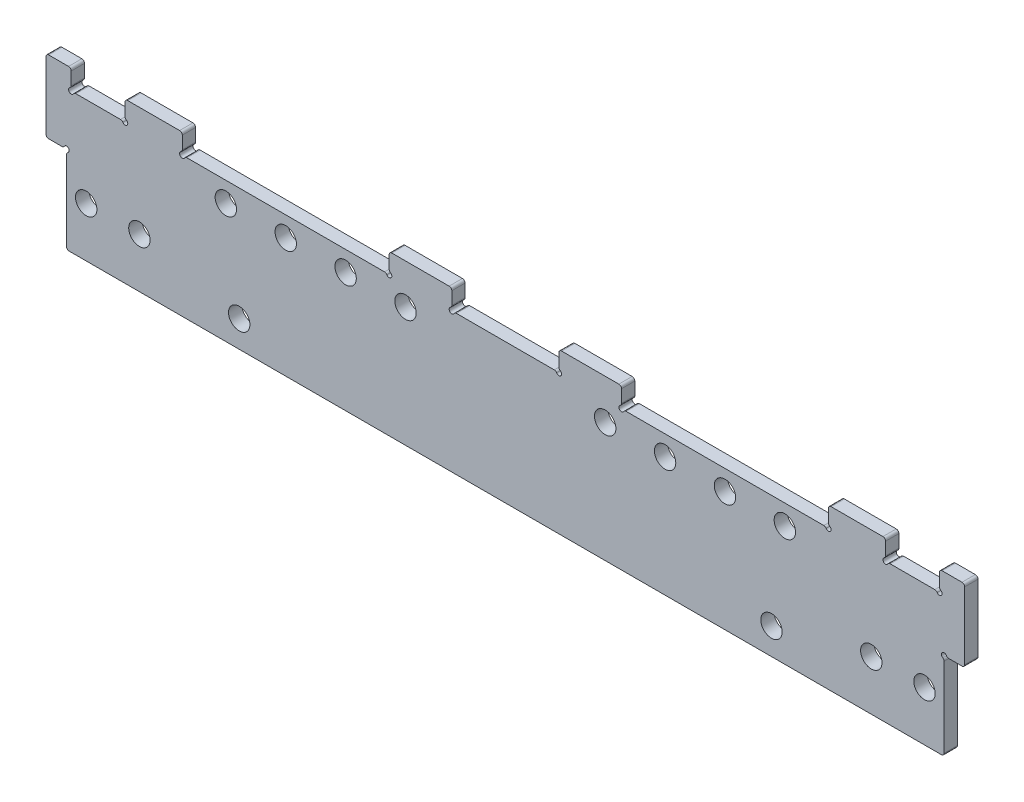
from build123d import *

# Parameters (mm, degrees)
SKETCH41_R                  = 2.5527
BACK_PLATE_EXTRUDE_DEPTH    = 3.175
SKETCH71_W                  = 8.89
SKETCH71_H                  = 4.7625
SKETCH71_W_2                = 13.79855
SKETCH71_W_3                = 15.09395
BOSS_EXTRUDE26_DEPTH        = 3.175
SKETCH91_W                  = 4.9022
SKETCH91_H                  = 20.7645
SKETCH91_W_2                = 12.8524
SKETCH91_H_2                = 4.7625
SKETCH91_W_3                = 49.3649
SKETCH91_W_4                = 12.7762
BACK_PLATE_TOLERENCES_DEPTH = 117.415175369
SKETCH92_W                  = 2.794
SKETCH92_H                  = 26.9875
CUT_EXTRUDE1_DEPTH          = 117.415175369
FILLET27_R                  = 0.635
FILLET28_R                  = 0.635
SKETCH93_R                  = 0.635
CUT_EXTRUDE2_DEPTH          = 114.719990469
FILLET29_R                  = 0.635
FILLET29_OF_MIRROR26_R      = 0.635


with BuildPart() as part:
    # Sketch41 → Back Plate Extrude------------ (new body)
    with BuildSketch(Plane.XY.offset(152.527)):
        Polygon((-104.775, -7.9375), (-104.775, 12.7), (-109.5248, 12.7), (-109.5248, 3.175), (-112.395, 3.175), (-112.395, 25.4), (-104.775, 25.4), (104.775, 25.4), (112.395, 25.4), (112.395, 3.175), (109.5248, 3.175), (109.5248, 12.7), (104.775, 12.7), (104.775, -7.9375), align=None)
        with Locations((-100.0125, 3.9624)):
            Circle(SKETCH41_R, mode=Mode.SUBTRACT)
        with Locations((100.0125, 3.9624)):
            Circle(SKETCH41_R, mode=Mode.SUBTRACT)
        with Locations((23.8252, 20.6375)):
            Circle(SKETCH41_R, mode=Mode.SUBTRACT)
        with Locations((38.1127, 20.6375)):
            Circle(SKETCH41_R, mode=Mode.SUBTRACT)
        with Locations((52.4002, 20.6375)):
            Circle(SKETCH41_R, mode=Mode.SUBTRACT)
        with Locations((66.6877, 20.6375)):
            Circle(SKETCH41_R, mode=Mode.SUBTRACT)
        with Locations(Location((-66.6877, 20.6375, 0), (0, 0, 180))):
            Circle(SKETCH41_R, mode=Mode.SUBTRACT)
        with Locations(Location((-52.4002, 20.6375, 0), (0, 0, 180))):
            Circle(SKETCH41_R, mode=Mode.SUBTRACT)
        with Locations(Location((-38.1127, 20.6375, 0), (0, 0, 180))):
            Circle(SKETCH41_R, mode=Mode.SUBTRACT)
        with Locations(Location((-23.8252, 20.6375, 0), (0, 0, 180))):
            Circle(SKETCH41_R, mode=Mode.SUBTRACT)
        with Locations((-87.3125, 3.9624)):
            Circle(SKETCH41_R, mode=Mode.SUBTRACT)
        with Locations(Location((87.3125, 3.9624, 0), (0, 0, 180))):
            Circle(SKETCH41_R, mode=Mode.SUBTRACT)
        with Locations((-63.5, -1.5875)):
            Circle(SKETCH41_R, mode=Mode.SUBTRACT)
        with Locations((63.5, -1.5875)):
            Circle(SKETCH41_R, mode=Mode.SUBTRACT)
    extrude(amount=BACK_PLATE_EXTRUDE_DEPTH)

    # Sketch71 → Boss-Extrude26 (add, through all)
    with BuildSketch(Plane.XY.offset(155.702)):
        with Locations((-107.95, 27.78125)):
            Rectangle(SKETCH71_W, SKETCH71_H)
        with Locations((-83.905725, 27.78125)):
            Rectangle(SKETCH71_W_2, SKETCH71_H)
        with Locations((-20.246975, 27.78125)):
            Rectangle(SKETCH71_W_3, SKETCH71_H)
    boss_extrude26 = extrude(amount=-BOSS_EXTRUDE26_DEPTH)

    # Mirror23: Boss-Extrude26 across plane
    add(boss_extrude26.mirror(Plane(origin=(0, 0, 0), x_dir=(0, 0, 1), z_dir=(1, 0, 0))))

    # Sketch91 → Back Plate Tolerences (cut, through all)
    with BuildSketch(Plane(origin=(0, 0, 152.527), x_dir=(-1, 0, 0), z_dir=(0, 0, -1))):
        with Locations((-107.1499, 2.44475)):
            Rectangle(SKETCH91_W, SKETCH91_H)
        with Locations((-97.155, 27.78125)):
            Rectangle(SKETCH91_W_2, SKETCH91_H_2)
        with Locations((-52.4002, 27.78125)):
            Rectangle(SKETCH91_W_3, SKETCH91_H_2)
        with Locations((-6.3881, 27.78125)):
            Rectangle(SKETCH91_W_4, SKETCH91_H_2)
    back_plate_tolerences = extrude(amount=-BACK_PLATE_TOLERENCES_DEPTH, mode=Mode.SUBTRACT)

    # Mirror25: Back Plate Tolerences across plane
    add(back_plate_tolerences.mirror(Plane(origin=(0, 0, 0), x_dir=(0, 0, 1), z_dir=(1, 0, 0))), mode=Mode.SUBTRACT)

    # Sketch92 → Cut-Extrude1 (cut, through all)
    with BuildSketch(Plane.XY.offset(155.702)):
        with Locations((-110.998, 16.66875)):
            Rectangle(SKETCH92_W, SKETCH92_H)
        with Locations((110.998, 16.66875)):
            Rectangle(SKETCH92_W, SKETCH92_H)
    extrude(amount=-CUT_EXTRUDE1_DEPTH, mode=Mode.SUBTRACT)

    # Fillet27
    fillet27_edges = [part.edges().sort_by_distance(p)[0] for p in [
        (104.6988, -7.9375, 154.1145),
        (109.601, 12.827, 154.1145),
        (-109.601, 12.827, 154.1145),
        (-104.6988, -7.9375, 154.1145),
        (-109.601, 30.1625, 154.1145),
        (109.601, 30.1625, 154.1145),
    ]]
    fillet(fillet27_edges, radius=FILLET27_R)

    # Fillet28
    fillet28_edges = [part.edges().sort_by_distance(p)[0] for p in [
        (103.5812, 30.1625, 154.1145),
        (90.7288, 30.1625, 154.1145),
        (77.08265, 30.1625, 154.1145),
        (27.71775, 30.1625, 154.1145),
        (12.7762, 30.1625, 154.1145),
        (-103.5812, 30.1625, 154.1145),
        (-90.7288, 30.1625, 154.1145),
        (-27.71775, 30.1625, 154.1145),
        (-77.08265, 30.1625, 154.1145),
        (-12.7762, 30.1625, 154.1145),
    ]]
    fillet(fillet28_edges, radius=FILLET28_R)

    # Sketch93 → Cut-Extrude2 (cut, through all)
    with BuildSketch(Plane.XY.offset(155.702)):
        with Locations((-104.6988, 12.827)):
            Circle(SKETCH93_R)
        with Locations((-103.5812, 25.4)):
            Circle(SKETCH93_R)
        with Locations((-90.7288, 25.4)):
            Circle(SKETCH93_R)
        with Locations((-77.08265, 25.4)):
            Circle(SKETCH93_R)
        with Locations((-27.71775, 25.4)):
            Circle(SKETCH93_R)
        with Locations((-12.7762, 25.4)):
            Circle(SKETCH93_R)
    cut_extrude2 = extrude(amount=-CUT_EXTRUDE2_DEPTH, mode=Mode.SUBTRACT)

    # Fillet29
    fillet29_edges = [part.edges().sort_by_distance(p)[0] for p in [
        (-105.3338, 12.827, 154.1145),
        (-103.5812, 26.035, 154.1145),
        (-27.71775, 26.035, 154.1145),
        (-12.7762, 26.035, 154.1145),
        (-90.7288, 26.035, 154.1145),
        (-77.08265, 26.035, 154.1145),
        (-104.6988, 12.192, 154.1145),
        (-102.9462, 25.4, 154.1145),
        (-91.3638, 25.4, 154.1145),
        (-76.44765, 25.4, 154.1145),
        (-28.35275, 25.4, 154.1145),
        (-12.1412, 25.4, 154.1145),
    ]]
    fillet(fillet29_edges, radius=FILLET29_R)

    # Mirror26: Cut-Extrude2 across plane
    add(cut_extrude2.mirror(Plane(origin=(0, 0, 0), x_dir=(0, 0, 1), z_dir=(1, 0, 0))), mode=Mode.SUBTRACT)

    # Fillet29 of Mirror26
    fillet29_of_mirror26_edges = [part.edges().sort_by_distance(p)[0] for p in [
        (105.3338, 12.827, 154.1145),
        (103.5812, 26.035, 154.1145),
        (27.71775, 26.035, 154.1145),
        (12.7762, 26.035, 154.1145),
        (90.7288, 26.035, 154.1145),
        (77.08265, 26.035, 154.1145),
        (104.6988, 12.192, 154.1145),
        (102.9462, 25.4, 154.1145),
        (91.3638, 25.4, 154.1145),
        (76.44765, 25.4, 154.1145),
        (28.35275, 25.4, 154.1145),
        (12.1412, 25.4, 154.1145),
    ]]
    fillet(fillet29_of_mirror26_edges, radius=FILLET29_OF_MIRROR26_R)


solid = part.part
